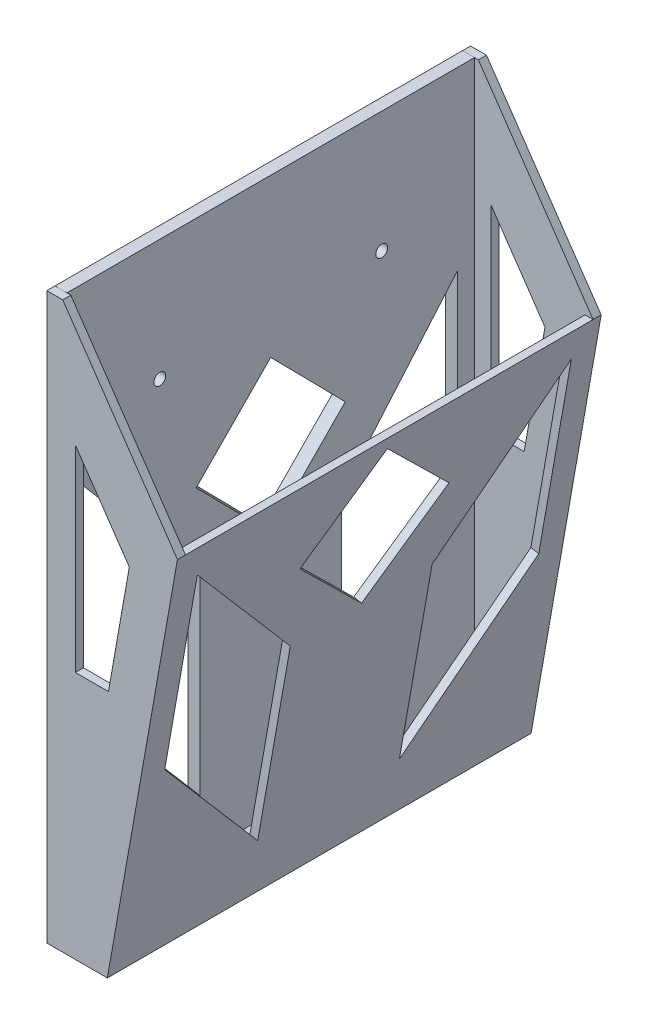
from build123d import *

# Parameters (mm, degrees)
BOSS_EXTRU_1_DEPTH         = 2
BOSS_EXTRU_2_DEPTH         = 102
R_P_TITION_LIN_AIRE1_COUNT = 2
R_P_TITION_LIN_AIRE1_PITCH = 103
ESQUISSE5_W                = 2.97567345
ESQUISSE5_H                = 101
BOSS_EXTRU_3_DEPTH         = 137
ESQUISSE6_W                = 2
ESQUISSE6_H                = 101
ESQUISSE9_R                = 1.462141601
ENL_V_MAT_EXTRU_8_DEPTH    = 10
ENL_V_MAT_EXTRU_10_DEPTH   = 178.957906594
ENL_V_MAT_EXTRU_11_DEPTH   = 178.957906594
ENL_V_MAT_EXTRU_12_DEPTH   = 178.97245401


with BuildPart() as part:
    # Esquisse2 → Boss.-Extru.1 (new body)
    with BuildSketch(Plane.XY):
        Polygon((0, 0), (0, 140), (3.942801894, 140), (32.364817767, 98.480775301), (15, 0), align=None)
    boss_extru_1 = extrude(amount=BOSS_EXTRU_1_DEPTH)

    # Esquisse4 → Boss.-Extru.2 (add)
    with BuildSketch(Plane.XY.offset(2)):
        Polygon((0, 0), (0, 3.006117571), (15.530059635, 3.006117571), (15, 0), align=None)
    extrude(amount=BOSS_EXTRU_2_DEPTH)

    # Répétition linéaire1: Boss.-Extru.1 ×2
    with Locations(*[(0, 0, i * R_P_TITION_LIN_AIRE1_PITCH) for i in range(1, R_P_TITION_LIN_AIRE1_COUNT)]):
        add(boss_extru_1)

    # Esquisse5 → Boss.-Extru.3 (add)
    with BuildSketch(Plane(origin=(0, 3.006117571, 0), x_dir=(1, 0, 0), z_dir=(0, 1, 0))):
        with Locations((1.487836725, -52.5)):
            Rectangle(ESQUISSE5_W, ESQUISSE5_H)
    extrude(amount=BOSS_EXTRU_3_DEPTH)

    # Balayage1: sweep along a curve in space
    with BuildLine() as balayage1_path:
        Line((15.530059635, 3.006117571, 103), (32.364817767, 98.480775301, 103))
    # Esquisse6 → Balayage1 (sweep)
    with BuildSketch(Plane(origin=(0, 3.006117571, 0), x_dir=(1, 0, 0), z_dir=(0, 1, 0))):
        with Locations((14.530059635, -52.5)):
            Rectangle(ESQUISSE6_W, ESQUISSE6_H)
    sweep(path=balayage1_path.line)

    # Esquisse9 → Enlèv. mat.-Extru.8 (cut)
    with BuildSketch(Plane(origin=(2.97567345, 0, 0), x_dir=(0, 0, -1), z_dir=(1, 0, 0))):
        with Locations((-80, 110)):
            Circle(ESQUISSE9_R)
    enl_v_mat_extru_8 = extrude(amount=-ENL_V_MAT_EXTRU_8_DEPTH, mode=Mode.SUBTRACT)

    # Symétrie3: Enlèv. mat.-Extru.8 across plane
    add(enl_v_mat_extru_8.mirror(Plane.XY.offset(52.5)), mode=Mode.SUBTRACT)

    # Esquisse11 → Enlèv. mat.-Extru.10 (cut, through all)
    with BuildSketch(Plane(origin=(14.547694656, -2.565151075, 0), x_dir=(0, 0, -1), z_dir=(0.9848077530122089, -0.17364817766692642, 0))):
        Polygon((-6.160430803, 48.968309083), (-6.160430803, 95.489627834), (-34.939480046, 62.478304571), (-34.939480046, 15.95698582), align=None)
    enl_v_mat_extru_10 = extrude(amount=-ENL_V_MAT_EXTRU_10_DEPTH, mode=Mode.SUBTRACT)

    # Symétrie4: Enlèv. mat.-Extru.10 across plane
    add(enl_v_mat_extru_10.mirror(Plane.XY.offset(52.5)), mode=Mode.SUBTRACT)

    # Esquisse13 → Enlèv. mat.-Extru.11 (cut, through all)
    with BuildSketch(Plane(origin=(14.547694656, -2.565151075, 0), x_dir=(0, 0, -1), z_dir=(0.9848077530122089, -0.17364817766692642, 0))):
        Polygon((-70.968675793, 81.423632051), (-52.5, 62.954956258), (-34.031324207, 81.423632051), (-52.5, 99.892307844), align=None)
    extrude(amount=-ENL_V_MAT_EXTRU_11_DEPTH, mode=Mode.SUBTRACT)

    # Esquisse14 → Enlèv. mat.-Extru.12 (cut, through all)
    with BuildSketch(Plane(origin=(0, 0, 0), x_dir=(-1, 0, 0), z_dir=(0, 0, -1))):
        Polygon((-7.076060975, 110.418465172), (-7.076060975, 61.600550279), (-15.271885521, 61.600550279), (-20.438019848, 90.899153967), align=None)
    extrude(amount=-ENL_V_MAT_EXTRU_12_DEPTH, mode=Mode.SUBTRACT)


solid = part.part
